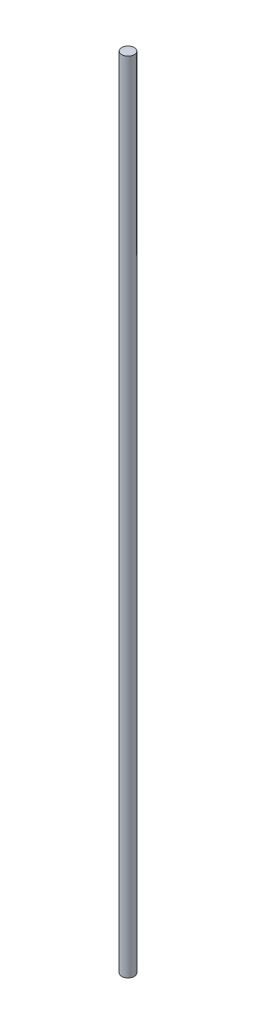
from build123d import *

# Parameters (mm, degrees)
SKETCH1_R           = 1.984375
BOSS_EXTRUDE1_DEPTH = 254


with BuildPart() as part:
    # Sketch1 → Boss-Extrude1 (new body)
    with BuildSketch(Plane(origin=(0, 0, 0), x_dir=(1, 0, 0), z_dir=(0, 1, 0))):
        with Locations(Location((0, 0, 0), (0, 0, 270))):
            Circle(SKETCH1_R)
    extrude(amount=BOSS_EXTRUDE1_DEPTH)


solid = part.part
